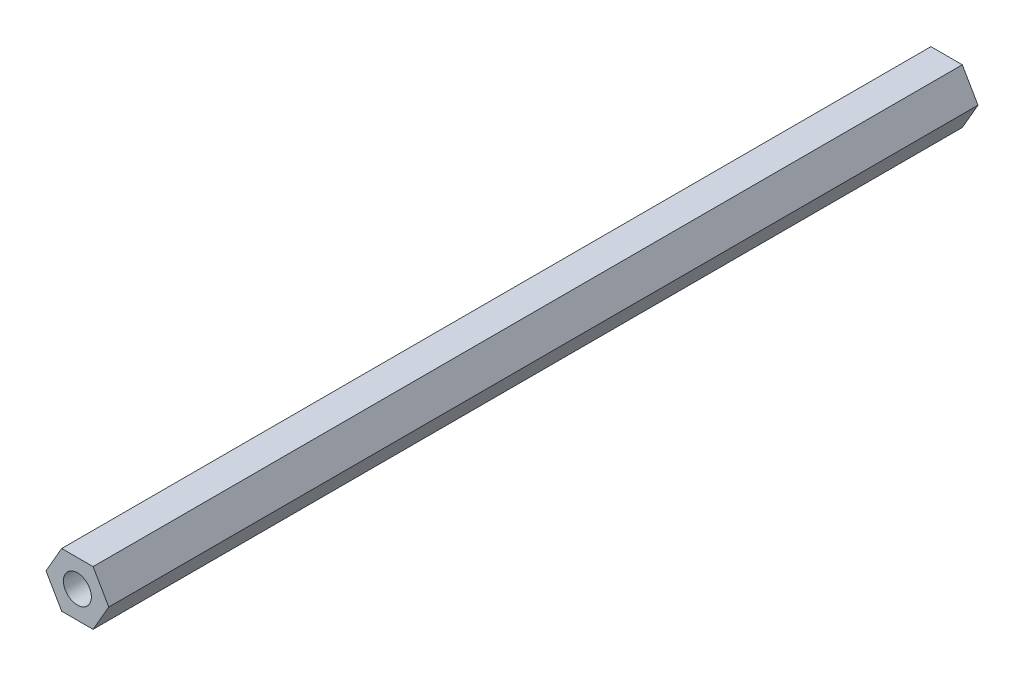
from build123d import *

# Parameters (mm, degrees)
SKETCH1_R           = 3.2639
BOSS_EXTRUDE1_DEPTH = 203.073


with BuildPart() as part:
    # Sketch1 → Boss-Extrude1 (new body)
    with BuildSketch(Plane.XY):
        Polygon((-7.332348419, 0), (-3.666174209, -6.35), (3.666174209, -6.35), (7.332348419, 0), (3.666174209, 6.35), (-3.666174209, 6.35), align=None)
        Circle(SKETCH1_R, mode=Mode.SUBTRACT)
    extrude(amount=BOSS_EXTRUDE1_DEPTH)


solid = part.part
